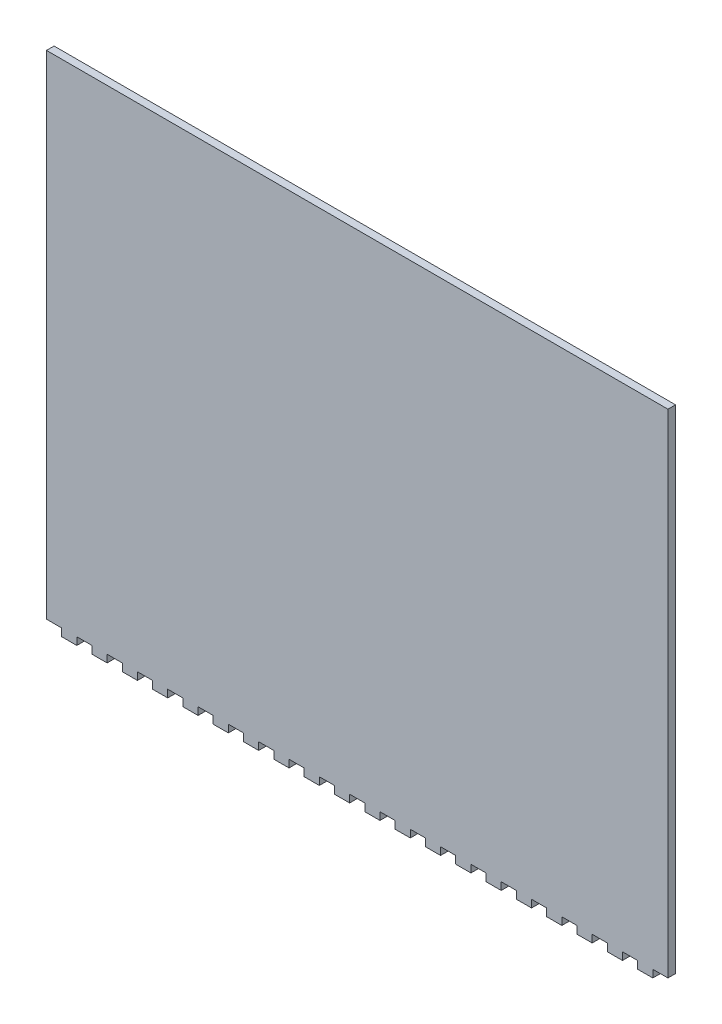
from build123d import *

# Parameters (mm, degrees)
ESQUISSE1_W             = 410
ESQUISSE1_H             = 330
BOSS_EXTRU_1_DEPTH      = 5
ESQUISSE2_W             = 10
ESQUISSE2_H             = 5
ENL_V_MAT_EXTRU_1_DEPTH = 527.331644498


with BuildPart() as part:
    # Esquisse1 → Boss.-Extru.1 (new body)
    with BuildSketch(Plane.XY):
        with Locations((205, 165)):
            Rectangle(ESQUISSE1_W, ESQUISSE1_H)
    extrude(amount=BOSS_EXTRU_1_DEPTH)

    # Esquisse2 → Enlèv. mat.-Extru.1 (cut, through all)
    with BuildSketch(Plane.XY.offset(5)):
        with Locations((25, 2.5)):
            Rectangle(ESQUISSE2_W, ESQUISSE2_H)
        with Locations((5, 2.5)):
            Rectangle(ESQUISSE2_W, ESQUISSE2_H)
        with Locations((45, 2.5)):
            Rectangle(ESQUISSE2_W, ESQUISSE2_H)
        with Locations((65, 2.5)):
            Rectangle(ESQUISSE2_W, ESQUISSE2_H)
        with Locations((85, 2.5)):
            Rectangle(ESQUISSE2_W, ESQUISSE2_H)
        with Locations((105, 2.5)):
            Rectangle(ESQUISSE2_W, ESQUISSE2_H)
        with Locations((125, 2.5)):
            Rectangle(ESQUISSE2_W, ESQUISSE2_H)
        with Locations((145, 2.5)):
            Rectangle(ESQUISSE2_W, ESQUISSE2_H)
        with Locations((165, 2.5)):
            Rectangle(ESQUISSE2_W, ESQUISSE2_H)
        with Locations((185, 2.5)):
            Rectangle(ESQUISSE2_W, ESQUISSE2_H)
        with Locations((205, 2.5)):
            Rectangle(ESQUISSE2_W, ESQUISSE2_H)
        with Locations((225, 2.5)):
            Rectangle(ESQUISSE2_W, ESQUISSE2_H)
        with Locations((245, 2.5)):
            Rectangle(ESQUISSE2_W, ESQUISSE2_H)
        with Locations((265, 2.5)):
            Rectangle(ESQUISSE2_W, ESQUISSE2_H)
        with Locations((285, 2.5)):
            Rectangle(ESQUISSE2_W, ESQUISSE2_H)
        with Locations((305, 2.5)):
            Rectangle(ESQUISSE2_W, ESQUISSE2_H)
        with Locations((325, 2.5)):
            Rectangle(ESQUISSE2_W, ESQUISSE2_H)
        with Locations((345, 2.5)):
            Rectangle(ESQUISSE2_W, ESQUISSE2_H)
        with Locations((365, 2.5)):
            Rectangle(ESQUISSE2_W, ESQUISSE2_H)
        with Locations((385, 2.5)):
            Rectangle(ESQUISSE2_W, ESQUISSE2_H)
        with Locations((405, 2.5)):
            Rectangle(ESQUISSE2_W, ESQUISSE2_H)
    extrude(amount=-ENL_V_MAT_EXTRU_1_DEPTH, mode=Mode.SUBTRACT)


solid = part.part
